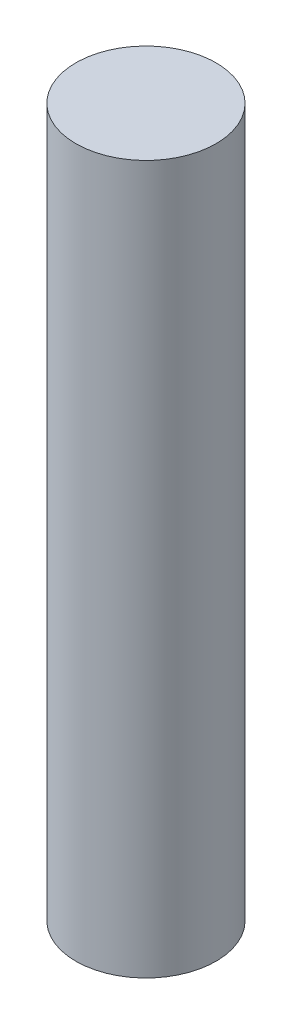
from build123d import *

# Parameters (mm, degrees)
SKETCH2_R           = 4.95
BOSS_EXTRUDE1_DEPTH = 50


with BuildPart() as part:
    # Sketch2 → Boss-Extrude1 (new body)
    with BuildSketch(Plane(origin=(0, 0, 0), x_dir=(1, 0, 0), z_dir=(0, 1, 0))):
        Circle(SKETCH2_R)
    extrude(amount=BOSS_EXTRUDE1_DEPTH)


solid = part.part
